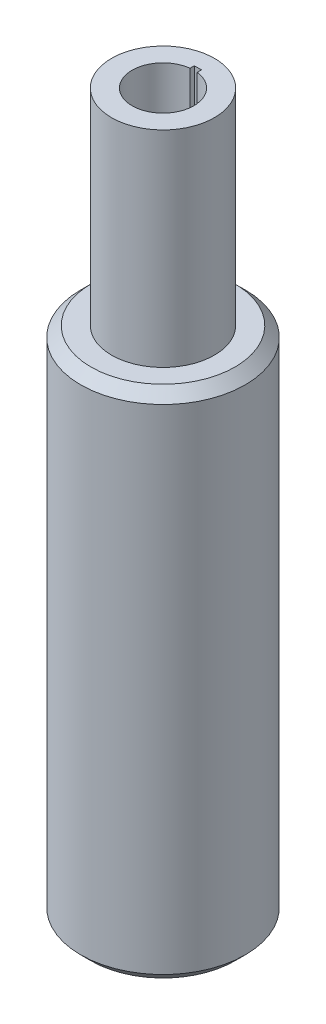
from build123d import *

# Parameters (mm, degrees)
CROQUIS1_R              = 4
SALIENTE_EXTRUIR1_DEPTH = 25
CROQUIS2_R              = 2.5
SALIENTE_EXTRUIR2_DEPTH = 10
CHAFL_N1_SIZE           = 0.5
CHAFL_N2_SIZE           = 0.5


with BuildPart() as part:
    # Croquis1 → Saliente-Extruir1 (new body)
    with BuildSketch(Plane(origin=(0, 0, 0), x_dir=(1, 0, 0), z_dir=(0, 1, 0))):
        with Locations(Location((0, 0, 0), (0, 0, 270))):
            Circle(CROQUIS1_R)
    extrude(amount=SALIENTE_EXTRUIR1_DEPTH)

    # Croquis2 → Saliente-Extruir2 (add)
    with BuildSketch(Plane(origin=(0, 25, 0), x_dir=(1, 0, 0), z_dir=(0, 1, 0))):
        with Locations(Location((0, 0, 0), (0, 0, 270))):
            Circle(CROQUIS2_R)
        with BuildLine():
            Line((-0.175, 1.489756692), (-0.175, 1.697953702))
            Line((-0.175, 1.697953702), (0.175, 1.697953702))
            Line((0.175, 1.697953702), (0.175, 1.489756692))
            ThreePointArc((0.175, 1.489756692), (0, -1.5), (-0.175, 1.489756692))
        make_face(mode=Mode.SUBTRACT)
    extrude(amount=SALIENTE_EXTRUIR2_DEPTH)

    # Chaflán1
    chafl_n1_edges = [part.edges().sort_by_distance(p)[0] for p in [
        (0, 25, -4),
    ]]
    chamfer(chafl_n1_edges, length=CHAFL_N1_SIZE)

    # Chaflán2
    chafl_n2_edges = [part.edges().sort_by_distance(p)[0] for p in [
        (0, 0, -4),
    ]]
    chamfer(chafl_n2_edges, length=CHAFL_N2_SIZE)


solid = part.part
